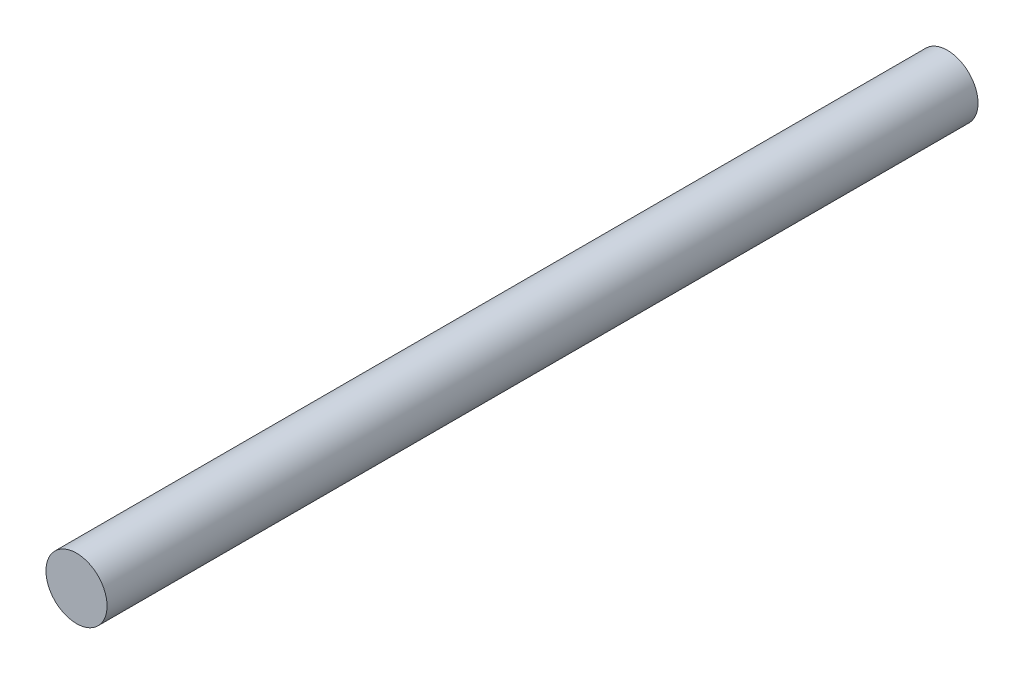
from build123d import *

# Parameters (mm, degrees)
SKETCH1_R           = 2.54
BOSS_EXTRUDE1_DEPTH = 72.39


with BuildPart() as part:
    # Sketch1 → Boss-Extrude1 (new body)
    with BuildSketch(Plane.XY):
        Circle(SKETCH1_R)
    extrude(amount=BOSS_EXTRUDE1_DEPTH)


solid = part.part
